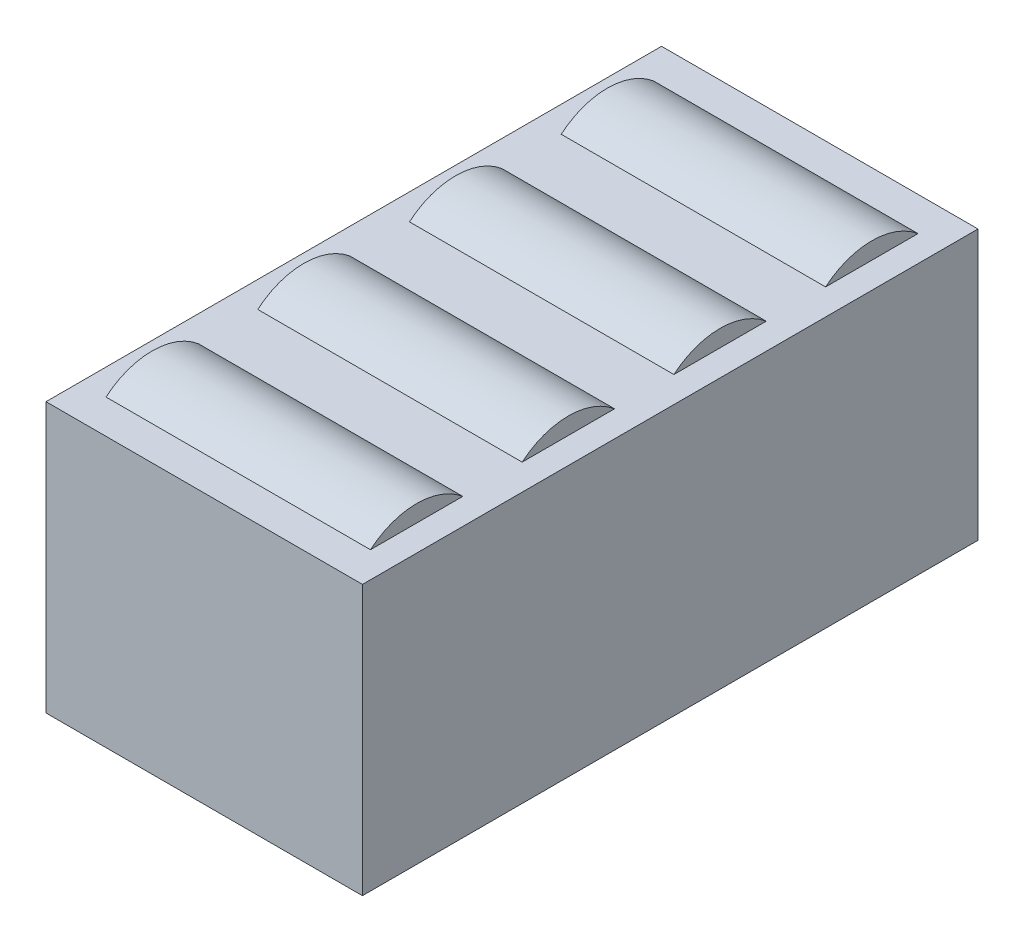
from build123d import *

# Parameters (mm, degrees)
ESQUISSE1_W        = 73
ESQUISSE1_H        = 62.2
BOSS_EXTRU_1_DEPTH = 142
BOSS_EXTRU_2_START = -6
ESQUISSE2_R        = 16.5
BOSS_EXTRU_2_DEPTH = 61


with BuildPart() as part:
    # Esquisse1 → Boss.-Extru.1 (new body)
    with BuildSketch(Plane.XY):
        with Locations((36.5, 31.1)):
            Rectangle(ESQUISSE1_W, ESQUISSE1_H)
    extrude(amount=BOSS_EXTRU_1_DEPTH)

    # Esquisse2 → Boss.-Extru.2 (add)
    with BuildSketch(Plane(origin=(73, 0, 0), x_dir=(0, 0, -1), z_dir=(1, 0, 0)).offset(BOSS_EXTRU_2_START)):
        with Locations((-123.5, 49.6)):
            Circle(ESQUISSE2_R)
        with Locations((-88.5, 49.6)):
            Circle(ESQUISSE2_R)
        with Locations((-53.5, 49.6)):
            Circle(ESQUISSE2_R)
        with Locations((-18.5, 49.6)):
            Circle(ESQUISSE2_R)
        with Locations((-123.5, 12.6)):
            Circle(ESQUISSE2_R)
        with Locations((-88.5, 12.6)):
            Circle(ESQUISSE2_R)
        with Locations((-53.5, 12.6)):
            Circle(ESQUISSE2_R)
        with Locations((-18.5, 12.6)):
            Circle(ESQUISSE2_R)
    extrude(amount=-BOSS_EXTRU_2_DEPTH)


solid = part.part
